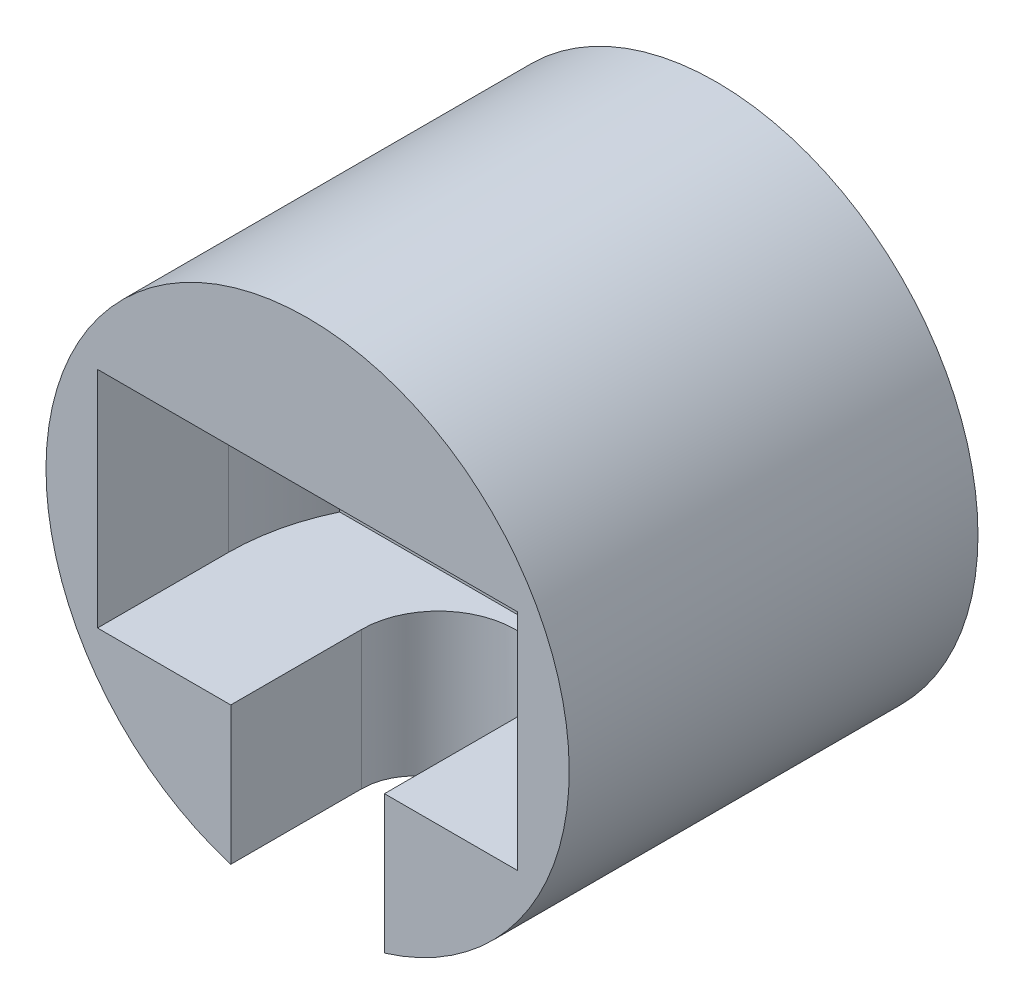
from build123d import *

# Parameters (mm, degrees)
SKETCH1_R               = 16
SKETCH1_R_2             = 3
BOSS_EXTRUDE1_DEPTH     = 25
CUT_EXTRUDE1_DEPTH      = 6.85
CUT_EXTRUDE2_REACH      = 35.719
CUT_EXTRUDE2_END_RADIUS = 16


with BuildPart() as part:
    # Sketch1 → Boss-Extrude1 (new body)
    with BuildSketch(Plane.XY):
        Circle(SKETCH1_R)
        Circle(SKETCH1_R_2, mode=Mode.SUBTRACT)
    extrude(amount=BOSS_EXTRUDE1_DEPTH)

    # Sketch2 → Cut-Extrude1 (cut, symmetric)
    with BuildSketch(Plane(origin=(0, 0, 0), x_dir=(1, 0, 0), z_dir=(0, 1, 0))):
        with BuildLine():
            Line((-11.589650556, -11.45), (11.589650556, -11.45))
            ThreePointArc((11.589650556, -11.45), (12.530951872, -14.154346265), (12.85, -17))
            Line((12.85, -17), (12.85, -25))
            Line((12.85, -25), (-12.85, -25))
            Line((-12.85, -25), (-12.85, -17))
            ThreePointArc((-12.85, -17), (-12.530951872, -14.154346265), (-11.589650556, -11.45))
        make_face()
    extrude(amount=CUT_EXTRUDE1_DEPTH, both=True, mode=Mode.SUBTRACT)

    # Cut-Extrude2: up to this cylinder (the profile starts inside it)
    cut_extrude2_end = Plane(origin=(0, 0, 19.107252), z_dir=(0, 0, -1)) * Cylinder(CUT_EXTRUDE2_END_RADIUS, 104.438, mode=Mode.PRIVATE)
    # Sketch3 → Cut-Extrude2 (cut, up to the surface)
    with BuildSketch(Plane(origin=(0, 0, 0), x_dir=(1, 0, 0), z_dir=(0, 1, 0)), mode=Mode.PRIVATE) as cut_extrude2_sk1:
        with BuildLine():
            Line((-4.7, -17), (-4.7, -25))
            Line((-4.7, -25), (4.7, -25))
            Line((4.7, -25), (4.7, -17))
            ThreePointArc((4.7, -17), (0, -12.3), (-4.7, -17))
        make_face()
    cut_extrude2_tool1 = extrude(cut_extrude2_sk1.sketch, amount=-CUT_EXTRUDE2_REACH, mode=Mode.PRIVATE) & cut_extrude2_end
    add(cut_extrude2_tool1.solids().sort_by_distance((0, 0, 19.107252))[0], mode=Mode.SUBTRACT)


solid = part.part
